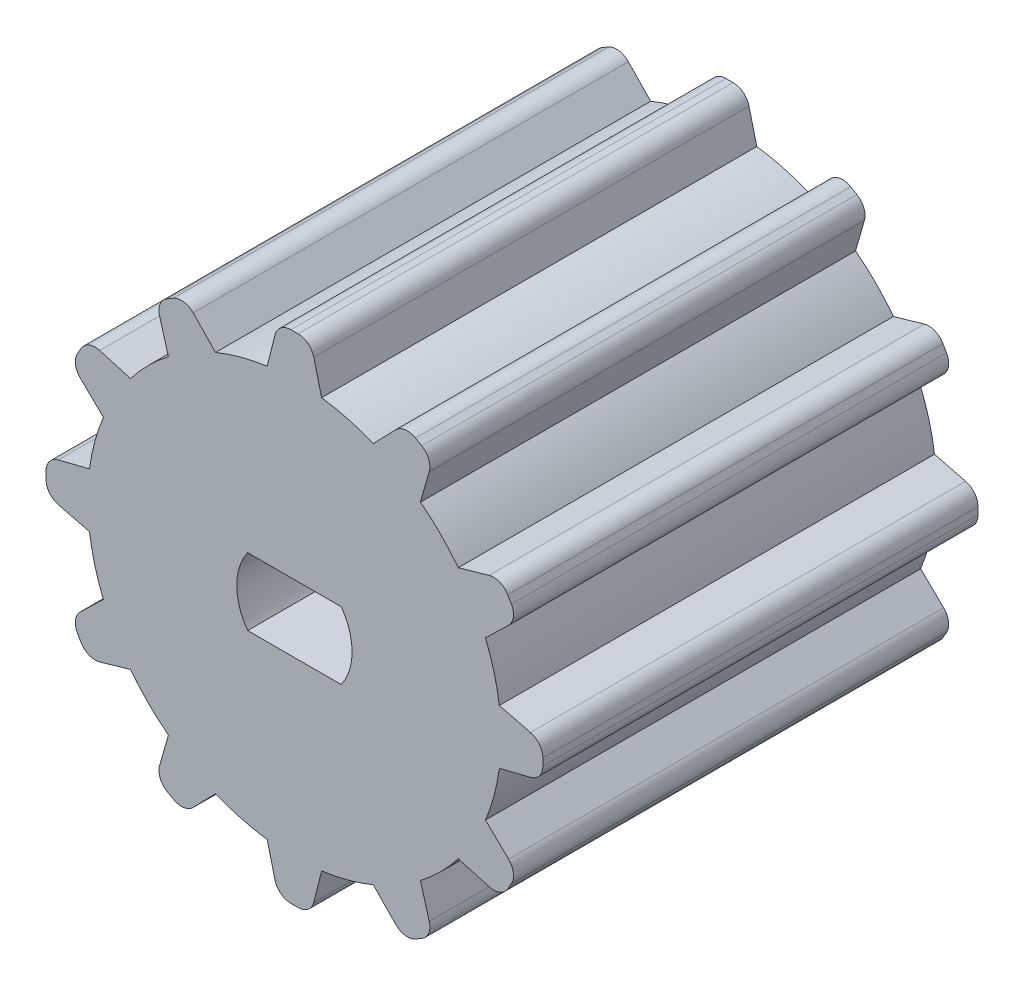
from build123d import *

# Parameters (mm, degrees)
Y_KSEKLIK_EKSTR_ZYON1_DEPTH = 20
IZIM2_R                     = 5
KES_EKSTR_ZYON1_DEPTH       = 15
IZIM3_R                     = 7.433299963
Y_KSEKLIK_EKSTR_ZYON2_DEPTH = 15
Y_KSEKLIK_EKSTR_ZYON3_DEPTH = 20
KES_EKSTR_ZYON2_DEPTH       = 20


with BuildPart() as part:
    # Çizim1 → Yükseklik-Ekstrüzyon1 (new body)
    with BuildSketch(Plane.XY):
        with BuildLine():
            Line((-1.25, 9.417404101), (-0.89202457, 10.84930582))
            ThreePointArc((-0.89202457, 10.84930582), (-0.625976852, 11.258558179), (-0.164417695, 11.417404101))
            Line((-0.164417695, 11.417404101), (0.164417695, 11.417404101))
            ThreePointArc((0.164417695, 11.417404101), (0.625976852, 11.258558179), (0.89202457, 10.84930582))
            Line((0.89202457, 10.84930582), (1.25, 9.417404101))
            ThreePointArc((1.25, 9.417404101), (2.458780928, 9.17629535), (3.626170296, 8.780711189))
            Line((3.626170296, 8.780711189), (4.652136971, 9.841786738))
            ThreePointArc((4.652136971, 9.841786738), (5.087167233, 10.063185819), (5.56631215, 9.969970844))
            Line((5.56631215, 9.969970844), (5.851091951, 9.805553149))
            ThreePointArc((5.851091951, 9.805553149), (6.171390946, 9.437208967), (6.197168849, 8.949762168))
            Line((6.197168849, 8.949762168), (5.791233805, 7.530711189))
            ThreePointArc((5.791233805, 7.530711189), (6.717514421, 6.717514421), (7.530711189, 5.791233805))
            Line((7.530711189, 5.791233805), (8.949762168, 6.197168849))
            ThreePointArc((8.949762168, 6.197168849), (9.437208967, 6.171390946), (9.805553149, 5.851091951))
            Line((9.805553149, 5.851091951), (9.969970844, 5.56631215))
            ThreePointArc((9.969970844, 5.56631215), (10.063185819, 5.087167233), (9.841786738, 4.652136971))
            Line((9.841786738, 4.652136971), (8.780711189, 3.626170296))
            ThreePointArc((8.780711189, 3.626170296), (9.17629535, 2.458780928), (9.417404101, 1.25))
            Line((9.417404101, 1.25), (10.84930582, 0.89202457))
            ThreePointArc((10.84930582, 0.89202457), (11.258558179, 0.625976852), (11.417404101, 0.164417695))
            Line((11.417404101, 0.164417695), (11.417404101, -0.164417695))
            ThreePointArc((11.417404101, -0.164417695), (11.258558179, -0.625976852), (10.84930582, -0.89202457))
            Line((10.84930582, -0.89202457), (9.417404101, -1.25))
            ThreePointArc((9.417404101, -1.25), (9.17629535, -2.458780928), (8.780711189, -3.626170296))
            Line((8.780711189, -3.626170296), (9.841786738, -4.652136971))
            ThreePointArc((9.841786738, -4.652136971), (10.063185819, -5.087167233), (9.969970844, -5.56631215))
            Line((9.969970844, -5.56631215), (9.805553149, -5.851091951))
            ThreePointArc((9.805553149, -5.851091951), (9.437208967, -6.171390946), (8.949762168, -6.197168849))
            Line((8.949762168, -6.197168849), (7.530711189, -5.791233805))
            ThreePointArc((7.530711189, -5.791233805), (6.717514421, -6.717514421), (5.791233805, -7.530711189))
            Line((5.791233805, -7.530711189), (6.197168849, -8.949762168))
            ThreePointArc((6.197168849, -8.949762168), (6.171390946, -9.437208967), (5.851091951, -9.805553149))
            Line((5.851091951, -9.805553149), (5.56631215, -9.969970844))
            ThreePointArc((5.56631215, -9.969970844), (5.087167233, -10.063185819), (4.652136971, -9.841786738))
            Line((4.652136971, -9.841786738), (3.626170296, -8.780711189))
            ThreePointArc((3.626170296, -8.780711189), (2.458780928, -9.17629535), (1.25, -9.417404101))
            Line((1.25, -9.417404101), (0.89202457, -10.84930582))
            ThreePointArc((0.89202457, -10.84930582), (0.625976852, -11.258558179), (0.164417695, -11.417404101))
            Line((0.164417695, -11.417404101), (-0.164417695, -11.417404101))
            ThreePointArc((-0.164417695, -11.417404101), (-0.625976852, -11.258558179), (-0.89202457, -10.84930582))
            Line((-0.89202457, -10.84930582), (-1.25, -9.417404101))
            ThreePointArc((-1.25, -9.417404101), (-2.458780928, -9.17629535), (-3.626170296, -8.780711189))
            Line((-3.626170296, -8.780711189), (-4.652136971, -9.841786738))
            ThreePointArc((-4.652136971, -9.841786738), (-5.087167233, -10.063185819), (-5.56631215, -9.969970844))
            Line((-5.56631215, -9.969970844), (-5.851091951, -9.805553149))
            ThreePointArc((-5.851091951, -9.805553149), (-6.171390946, -9.437208967), (-6.197168849, -8.949762168))
            Line((-6.197168849, -8.949762168), (-5.791233805, -7.530711189))
            ThreePointArc((-5.791233805, -7.530711189), (-6.717514421, -6.717514421), (-7.530711189, -5.791233805))
            Line((-7.530711189, -5.791233805), (-8.949762168, -6.197168849))
            ThreePointArc((-8.949762168, -6.197168849), (-9.437208967, -6.171390946), (-9.805553149, -5.851091951))
            Line((-9.805553149, -5.851091951), (-9.969970844, -5.56631215))
            ThreePointArc((-9.969970844, -5.56631215), (-10.063185819, -5.087167233), (-9.841786738, -4.652136971))
            Line((-9.841786738, -4.652136971), (-8.780711189, -3.626170296))
            ThreePointArc((-8.780711189, -3.626170296), (-9.17629535, -2.458780928), (-9.417404101, -1.25))
            Line((-9.417404101, -1.25), (-10.84930582, -0.89202457))
            ThreePointArc((-10.84930582, -0.89202457), (-11.258558179, -0.625976852), (-11.417404101, -0.164417695))
            Line((-11.417404101, -0.164417695), (-11.417404101, 0.164417695))
            ThreePointArc((-11.417404101, 0.164417695), (-11.258558179, 0.625976852), (-10.84930582, 0.89202457))
            Line((-10.84930582, 0.89202457), (-9.417404101, 1.25))
            ThreePointArc((-9.417404101, 1.25), (-9.17629535, 2.458780928), (-8.780711189, 3.626170296))
            Line((-8.780711189, 3.626170296), (-9.841786738, 4.652136971))
            ThreePointArc((-9.841786738, 4.652136971), (-10.063185819, 5.087167233), (-9.969970844, 5.56631215))
            Line((-9.969970844, 5.56631215), (-9.805553149, 5.851091951))
            ThreePointArc((-9.805553149, 5.851091951), (-9.437208967, 6.171390946), (-8.949762168, 6.197168849))
            Line((-8.949762168, 6.197168849), (-7.530711189, 5.791233805))
            ThreePointArc((-7.530711189, 5.791233805), (-6.717514421, 6.717514421), (-5.791233805, 7.530711189))
            Line((-5.791233805, 7.530711189), (-6.197168849, 8.949762168))
            ThreePointArc((-6.197168849, 8.949762168), (-6.171390946, 9.437208967), (-5.851091951, 9.805553149))
            Line((-5.851091951, 9.805553149), (-5.56631215, 9.969970844))
            ThreePointArc((-5.56631215, 9.969970844), (-5.087167233, 10.063185819), (-4.652136971, 9.841786738))
            Line((-4.652136971, 9.841786738), (-3.626170296, 8.780711189))
            ThreePointArc((-3.626170296, 8.780711189), (-2.458780928, 9.17629535), (-1.25, 9.417404101))
        make_face()
    extrude(amount=-Y_KSEKLIK_EKSTR_ZYON1_DEPTH)

    # Çizim2 → Kes-Ekstrüzyon1 (cut)
    with BuildSketch(Plane(origin=(0, 0, -20), x_dir=(-1, 0, 0), z_dir=(0, 0, -1))):
        Circle(IZIM2_R)
    extrude(amount=-KES_EKSTR_ZYON1_DEPTH, mode=Mode.SUBTRACT)

    # Çizim3 → Yükseklik-Ekstrüzyon2 (add)
    with BuildSketch(Plane(origin=(0, 0, -20), x_dir=(-1, 0, 0), z_dir=(0, 0, -1))):
        Circle(IZIM3_R)
        with BuildLine():
            Line((-2.154065923, 2.5), (2.154065923, 2.5))
            ThreePointArc((2.154065923, 2.5), (0, -3.3), (-2.154065923, 2.5))
        make_face(mode=Mode.SUBTRACT)
    extrude(amount=-Y_KSEKLIK_EKSTR_ZYON2_DEPTH)

    # Çizim1<2> → Yükseklik-Ekstrüzyon3 (add)
    with BuildSketch(Plane.XY):
        with BuildLine():
            Line((-1.25, 9.417404101), (-0.89202457, 10.84930582))
            ThreePointArc((-0.89202457, 10.84930582), (-0.625976852, 11.258558179), (-0.164417695, 11.417404101))
            Line((-0.164417695, 11.417404101), (0.164417695, 11.417404101))
            ThreePointArc((0.164417695, 11.417404101), (0.625976852, 11.258558179), (0.89202457, 10.84930582))
            Line((0.89202457, 10.84930582), (1.25, 9.417404101))
            ThreePointArc((1.25, 9.417404101), (2.458780928, 9.17629535), (3.626170296, 8.780711189))
            Line((3.626170296, 8.780711189), (4.652136971, 9.841786738))
            ThreePointArc((4.652136971, 9.841786738), (5.087167233, 10.063185819), (5.56631215, 9.969970844))
            Line((5.56631215, 9.969970844), (5.851091951, 9.805553149))
            ThreePointArc((5.851091951, 9.805553149), (6.171390946, 9.437208967), (6.197168849, 8.949762168))
            Line((6.197168849, 8.949762168), (5.791233805, 7.530711189))
            ThreePointArc((5.791233805, 7.530711189), (6.717514421, 6.717514421), (7.530711189, 5.791233805))
            Line((7.530711189, 5.791233805), (8.949762168, 6.197168849))
            ThreePointArc((8.949762168, 6.197168849), (9.437208967, 6.171390946), (9.805553149, 5.851091951))
            Line((9.805553149, 5.851091951), (9.969970844, 5.56631215))
            ThreePointArc((9.969970844, 5.56631215), (10.063185819, 5.087167233), (9.841786738, 4.652136971))
            Line((9.841786738, 4.652136971), (8.780711189, 3.626170296))
            ThreePointArc((8.780711189, 3.626170296), (9.17629535, 2.458780928), (9.417404101, 1.25))
            Line((9.417404101, 1.25), (10.84930582, 0.89202457))
            ThreePointArc((10.84930582, 0.89202457), (11.258558179, 0.625976852), (11.417404101, 0.164417695))
            Line((11.417404101, 0.164417695), (11.417404101, -0.164417695))
            ThreePointArc((11.417404101, -0.164417695), (11.258558179, -0.625976852), (10.84930582, -0.89202457))
            Line((10.84930582, -0.89202457), (9.417404101, -1.25))
            ThreePointArc((9.417404101, -1.25), (9.17629535, -2.458780928), (8.780711189, -3.626170296))
            Line((8.780711189, -3.626170296), (9.841786738, -4.652136971))
            ThreePointArc((9.841786738, -4.652136971), (10.063185819, -5.087167233), (9.969970844, -5.56631215))
            Line((9.969970844, -5.56631215), (9.805553149, -5.851091951))
            ThreePointArc((9.805553149, -5.851091951), (9.437208967, -6.171390946), (8.949762168, -6.197168849))
            Line((8.949762168, -6.197168849), (7.530711189, -5.791233805))
            ThreePointArc((7.530711189, -5.791233805), (6.717514421, -6.717514421), (5.791233805, -7.530711189))
            Line((5.791233805, -7.530711189), (6.197168849, -8.949762168))
            ThreePointArc((6.197168849, -8.949762168), (6.171390946, -9.437208967), (5.851091951, -9.805553149))
            Line((5.851091951, -9.805553149), (5.56631215, -9.969970844))
            ThreePointArc((5.56631215, -9.969970844), (5.087167233, -10.063185819), (4.652136971, -9.841786738))
            Line((4.652136971, -9.841786738), (3.626170296, -8.780711189))
            ThreePointArc((3.626170296, -8.780711189), (2.458780928, -9.17629535), (1.25, -9.417404101))
            Line((1.25, -9.417404101), (0.89202457, -10.84930582))
            ThreePointArc((0.89202457, -10.84930582), (0.625976852, -11.258558179), (0.164417695, -11.417404101))
            Line((0.164417695, -11.417404101), (-0.164417695, -11.417404101))
            ThreePointArc((-0.164417695, -11.417404101), (-0.625976852, -11.258558179), (-0.89202457, -10.84930582))
            Line((-0.89202457, -10.84930582), (-1.25, -9.417404101))
            ThreePointArc((-1.25, -9.417404101), (-2.458780928, -9.17629535), (-3.626170296, -8.780711189))
            Line((-3.626170296, -8.780711189), (-4.652136971, -9.841786738))
            ThreePointArc((-4.652136971, -9.841786738), (-5.087167233, -10.063185819), (-5.56631215, -9.969970844))
            Line((-5.56631215, -9.969970844), (-5.851091951, -9.805553149))
            ThreePointArc((-5.851091951, -9.805553149), (-6.171390946, -9.437208967), (-6.197168849, -8.949762168))
            Line((-6.197168849, -8.949762168), (-5.791233805, -7.530711189))
            ThreePointArc((-5.791233805, -7.530711189), (-6.717514421, -6.717514421), (-7.530711189, -5.791233805))
            Line((-7.530711189, -5.791233805), (-8.949762168, -6.197168849))
            ThreePointArc((-8.949762168, -6.197168849), (-9.437208967, -6.171390946), (-9.805553149, -5.851091951))
            Line((-9.805553149, -5.851091951), (-9.969970844, -5.56631215))
            ThreePointArc((-9.969970844, -5.56631215), (-10.063185819, -5.087167233), (-9.841786738, -4.652136971))
            Line((-9.841786738, -4.652136971), (-8.780711189, -3.626170296))
            ThreePointArc((-8.780711189, -3.626170296), (-9.17629535, -2.458780928), (-9.417404101, -1.25))
            Line((-9.417404101, -1.25), (-10.84930582, -0.89202457))
            ThreePointArc((-10.84930582, -0.89202457), (-11.258558179, -0.625976852), (-11.417404101, -0.164417695))
            Line((-11.417404101, -0.164417695), (-11.417404101, 0.164417695))
            ThreePointArc((-11.417404101, 0.164417695), (-11.258558179, 0.625976852), (-10.84930582, 0.89202457))
            Line((-10.84930582, 0.89202457), (-9.417404101, 1.25))
            ThreePointArc((-9.417404101, 1.25), (-9.17629535, 2.458780928), (-8.780711189, 3.626170296))
            Line((-8.780711189, 3.626170296), (-9.841786738, 4.652136971))
            ThreePointArc((-9.841786738, 4.652136971), (-10.063185819, 5.087167233), (-9.969970844, 5.56631215))
            Line((-9.969970844, 5.56631215), (-9.805553149, 5.851091951))
            ThreePointArc((-9.805553149, 5.851091951), (-9.437208967, 6.171390946), (-8.949762168, 6.197168849))
            Line((-8.949762168, 6.197168849), (-7.530711189, 5.791233805))
            ThreePointArc((-7.530711189, 5.791233805), (-6.717514421, 6.717514421), (-5.791233805, 7.530711189))
            Line((-5.791233805, 7.530711189), (-6.197168849, 8.949762168))
            ThreePointArc((-6.197168849, 8.949762168), (-6.171390946, 9.437208967), (-5.851091951, 9.805553149))
            Line((-5.851091951, 9.805553149), (-5.56631215, 9.969970844))
            ThreePointArc((-5.56631215, 9.969970844), (-5.087167233, 10.063185819), (-4.652136971, 9.841786738))
            Line((-4.652136971, 9.841786738), (-3.626170296, 8.780711189))
            ThreePointArc((-3.626170296, 8.780711189), (-2.458780928, 9.17629535), (-1.25, 9.417404101))
        make_face()
    extrude(amount=-Y_KSEKLIK_EKSTR_ZYON3_DEPTH)

    # Çizim4 → Kes-Ekstrüzyon2 (cut)
    with BuildSketch(Plane.XY):
        with BuildLine():
            Line((-2.149418526, 1.55), (2.149418526, 1.55))
            ThreePointArc((2.149418526, 1.55), (2.65, 0), (2.149418526, -1.55))
            Line((2.149418526, -1.55), (-2.149418526, -1.55))
            ThreePointArc((-2.149418526, -1.55), (-2.65, 0), (-2.149418526, 1.55))
        make_face()
    extrude(amount=-KES_EKSTR_ZYON2_DEPTH, mode=Mode.SUBTRACT)


solid = part.part
